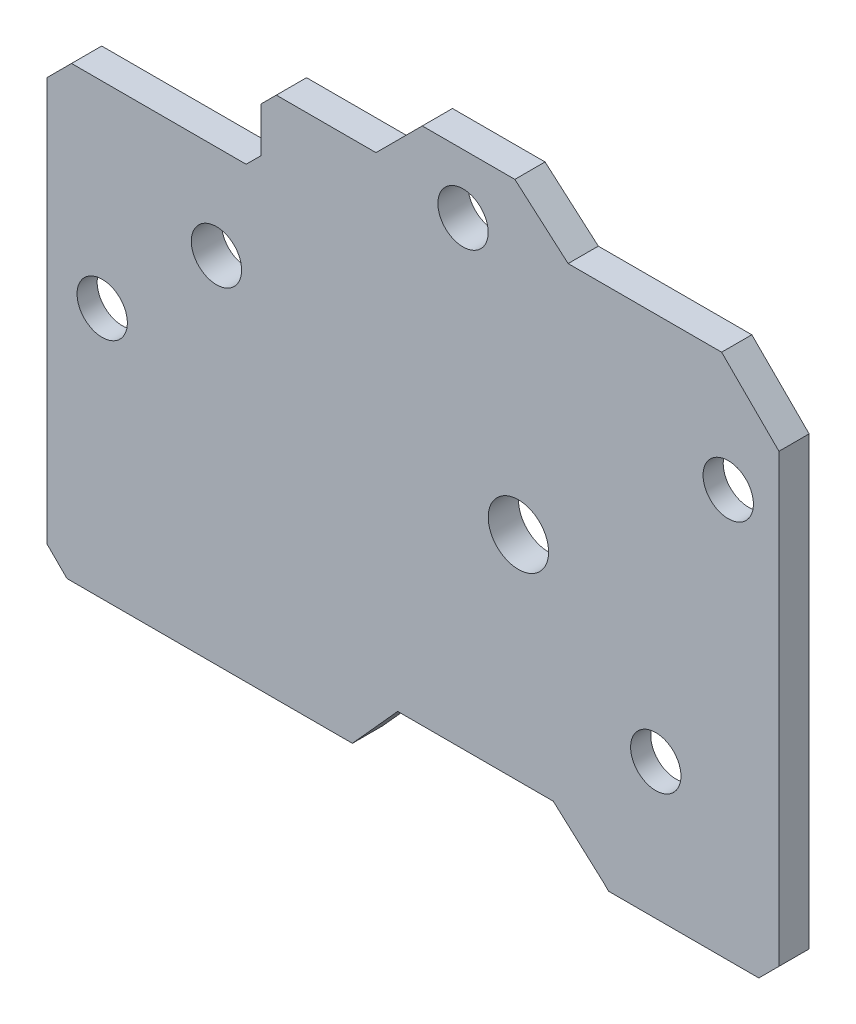
from build123d import *

# Parameters (mm, degrees)
SKETCH_1_R          = 3
SKETCH_1_R_2        = 2.5
EXTRUDE_1_DEPTH     = 3
EXTRUDE_START       = -2
SKETCH_3_R          = 2.5
EXTRUDE_3_DEPTH     = 2
SKETCH_7_R          = 2.65
CUT_EXTRUDE_1_DEPTH = 1
CHAMFER_1_SIZE      = 1
CUT_EXTRUDE_3_REACH = 53.614
SKETCH_10_R         = 2.5
CUT_EXTRUDE_4_REACH = 53.662
CHAMFER_2_SIZE      = 1.5
CUT_EXTRUDE_5_REACH = 53.662
CHAMFER_3_SIZE      = 2


with BuildPart() as part:
    # 스케치1 → 보스-돌출1 (new body)
    with BuildSketch(Plane.XY):
        with BuildLine():
            Line((-27.349187557, -28.196867314), (-7.694270353, -28.196867314))
            Line((-7.694270353, -28.196867314), (-3.192250131, -23.196867314))
            Line((-3.192250131, -23.196867314), (12.267749869, -23.196867314))
            Line((12.267749869, -23.196867314), (17.250812443, -27.683637009))
            Line((17.250812443, -27.683637009), (17.250812443, -14.696867314))
            ThreePointArc((17.250812443, -14.696867314), (22.450812443, -9.496867314), (27.650812443, -14.696867314))
            Line((27.650812443, -14.696867314), (27.650812443, -28.196867314))
            Line((27.650812443, -28.196867314), (40.650812443, -28.196867314))
            Line((40.650812443, -28.196867314), (40.650812443, 12.183132686))
            Line((40.650812443, 12.183132686), (28.992507116, 23.803132686))
            Line((28.992507116, 23.803132686), (13.742507116, 23.803132686))
            Line((13.742507116, 23.803132686), (8.450812443, 28.403132686))
            Line((8.450812443, 28.403132686), (-0.749187557, 28.403132686))
            Line((-0.749187557, 28.403132686), (-5.349187557, 23.803132686))
            Line((-5.349187557, 23.803132686), (-28.149187557, 23.803132686))
            Line((-28.149187557, 23.803132686), (-43.049187557, 8.903132686))
            Line((-43.049187557, 8.903132686), (-43.049187557, -28.196867314))
            Line((-43.049187557, -28.196867314), (-37.749187557, -28.196867314))
            Line((-37.749187557, -28.196867314), (-37.749187557, -3.196867314))
            ThreePointArc((-37.749187557, -3.196867314), (-29.949187557, 1.306464785), (-29.949187557, -7.700199414))
            Line((-29.949187557, -7.700199414), (-29.949187557, -28.196867314))
            Line((-29.949187557, -28.196867314), (-27.349187557, -28.196867314))
        make_face()
        with Locations((8.802507116, -1.986867314)):
            Circle(SKETCH_1_R, mode=Mode.SUBTRACT)
        with Locations((-21.197492884, 7.013132686)):
            Circle(SKETCH_1_R_2, mode=Mode.SUBTRACT)
        with Locations((3.302507116, 22.513132686)):
            Circle(SKETCH_1_R_2, mode=Mode.SUBTRACT)
    extrude(amount=EXTRUDE_1_DEPTH)

    # 스케치3 → 보스-돌출3 (add)
    # profile 1 of 2: a face of its own
    with BuildSketch(Plane.XY.offset(3).offset(EXTRUDE_START)):
        with BuildLine():
            Line((27.650812443, -14.696867314), (27.650812443, -28.196867314))
            Line((27.650812443, -28.196867314), (17.764042748, -28.196867314))
            Line((17.764042748, -28.196867314), (17.250812443, -27.683637009))
            Line((17.250812443, -27.683637009), (17.250812443, -14.696867314))
            ThreePointArc((17.250812443, -14.696867314), (22.450812443, -9.496867314), (27.650812443, -14.696867314))
        make_face()
        with Locations((22.450812443, -14.696867314)):
            Circle(SKETCH_3_R, mode=Mode.SUBTRACT)
    # profile 2 of 2: a face of its own
    with BuildSketch(Plane.XY.offset(3).offset(EXTRUDE_START)):
        with BuildLine():
            Line((-29.949187557, -7.700199414), (-29.949187557, -28.196867314))
            Line((-29.949187557, -28.196867314), (-30.049187557, -28.196867314))
            Line((-30.049187557, -28.196867314), (-37.749187557, -28.196867314))
            Line((-37.749187557, -28.196867314), (-37.749187557, -3.196867314))
            ThreePointArc((-37.749187557, -3.196867314), (-29.949187557, 1.306464785), (-29.949187557, -7.700199414))
        make_face()
        with Locations((-32.549187557, -3.196867314)):
            Circle(SKETCH_3_R, mode=Mode.SUBTRACT)
    extrude(amount=EXTRUDE_3_DEPTH)

    # 스케치7 → 컷-돌출1 (cut)
    with BuildSketch(Plane(origin=(0, 0, 0), x_dir=(-1, 0, 0), z_dir=(0, 0, -1))):
        with Locations((6.149187557, 20.803132686)):
            Circle(SKETCH_7_R)
        with Locations((8.049187557, -24.196867314)):
            Circle(SKETCH_7_R)
        with BuildLine():
            Line((-26.406412787, 7.908733029), (-32.895212099, 7.908733029))
            ThreePointArc((-32.895212099, 7.908733029), (-33.708384897, 8.245560231), (-34.045212099, 9.058733029))
            Line((-34.045212099, 9.058733029), (-34.045212099, 15.547532342))
            ThreePointArc((-34.045212099, 15.547532342), (-33.708384897, 16.36070514), (-32.895212099, 16.697532342))
            Line((-32.895212099, 16.697532342), (-29.650812443, 16.697532342))
            ThreePointArc((-29.650812443, 16.697532342), (-26.543502647, 15.410442482), (-25.256412787, 12.303132686))
            Line((-25.256412787, 12.303132686), (-25.256412787, 9.058733029))
            ThreePointArc((-25.256412787, 9.058733029), (-25.593239988, 8.245560231), (-26.406412787, 7.908733029))
        make_face()
    extrude(amount=-CUT_EXTRUDE_1_DEPTH, mode=Mode.SUBTRACT)

    # 모따기1
    chamfer_1_edges = [part.edges().sort_by_distance(p)[0] for p in [
        (-43.049187557, -28.196867314, 1.5),
        (40.650812443, -28.196867314, 1.5),
    ]]
    chamfer(chamfer_1_edges, length=CHAMFER_1_SIZE)

    # 스케치10 → 컷-돌출3 (cut, up to next)
    with BuildSketch(Plane(origin=(0, 0, 1), x_dir=(-1, 0, 0), z_dir=(0, 0, -1)), mode=Mode.PRIVATE) as cut_extrude_3_sk1:
        with Locations((-29.650812443, 12.303132686)):
            Circle(SKETCH_10_R)
    cut_extrude_3_tool1 = extrude(cut_extrude_3_sk1.sketch, amount=-CUT_EXTRUDE_3_REACH, mode=Mode.PRIVATE) & part.part
    add(cut_extrude_3_tool1.solids().sort_by_distance((29.650812, 12.303133, 1))[0], mode=Mode.SUBTRACT)

    # 스케치12 → 컷-돌출4 (cut, up to next)
    with BuildSketch(Plane(origin=(0, 0, 0), x_dir=(-1, 0, 0), z_dir=(0, 0, -1)), mode=Mode.PRIVATE) as cut_extrude_4_sk1:
        Polygon((16.749187557, 23.803132686), (16.749187557, 16.353132686), (35.599187557, 16.353132686), (28.149187557, 23.803132686), align=None)
    cut_extrude_4_tool1 = extrude(cut_extrude_4_sk1.sketch, amount=-CUT_EXTRUDE_4_REACH, mode=Mode.PRIVATE) & part.part
    add(cut_extrude_4_tool1.solids().sort_by_distance((-24.464587, 19.772334, 0))[0], mode=Mode.SUBTRACT)

    # 모따기2
    chamfer_2_edges = [part.edges().sort_by_distance(p)[0] for p in [
        (-16.749187557, 23.803132686, 1.5),
        (-16.749187557, 16.353132686, 1.5),
    ]]
    chamfer(chamfer_2_edges, length=CHAMFER_2_SIZE)

    # 스케치13 → 컷-돌출5 (cut, up to next)
    with BuildSketch(Plane(origin=(0, 0, 0), x_dir=(-1, 0, 0), z_dir=(0, 0, -1)), mode=Mode.PRIVATE) as cut_extrude_5_sk1:
        Polygon((-34.689283113, 18.125074406), (-34.689283113, -28.196867314), (-39.650812443, -28.196867314), (-40.650812443, -27.196867314), (-40.650812443, 12.183132686), align=None)
    cut_extrude_5_tool1 = extrude(cut_extrude_5_sk1.sketch, amount=-CUT_EXTRUDE_5_REACH, mode=Mode.PRIVATE) & part.part
    # 스케치13 → 컷-돌출5 (cut, up to next)
    with BuildSketch(Plane(origin=(0, 0, 0), x_dir=(-1, 0, 0), z_dir=(0, 0, -1)), mode=Mode.PRIVATE) as cut_extrude_5_sk2:
        Polygon((38.049187557, 13.903132686), (43.049187557, 8.903132686), (43.049187557, -27.196867314), (42.049187557, -28.196867314), (38.049187557, -28.196867314), align=None)
    cut_extrude_5_tool2 = extrude(cut_extrude_5_sk2.sketch, amount=-CUT_EXTRUDE_5_REACH, mode=Mode.PRIVATE) & part.part
    add(cut_extrude_5_tool1.solids().sort_by_distance((37.59669, -6.446011, 0))[0], mode=Mode.SUBTRACT)
    add(cut_extrude_5_tool2.solids().sort_by_distance((-40.49096, -8.321213, 0))[0], mode=Mode.SUBTRACT)

    # 모따기3
    chamfer_3_edges = [part.edges().sort_by_distance(p)[0] for p in [
        (-38.049187557, -28.196867314, 1.5),
        (34.689283113, -28.196867314, 1.5),
    ]]
    chamfer(chamfer_3_edges, length=CHAMFER_3_SIZE)


solid = part.part
